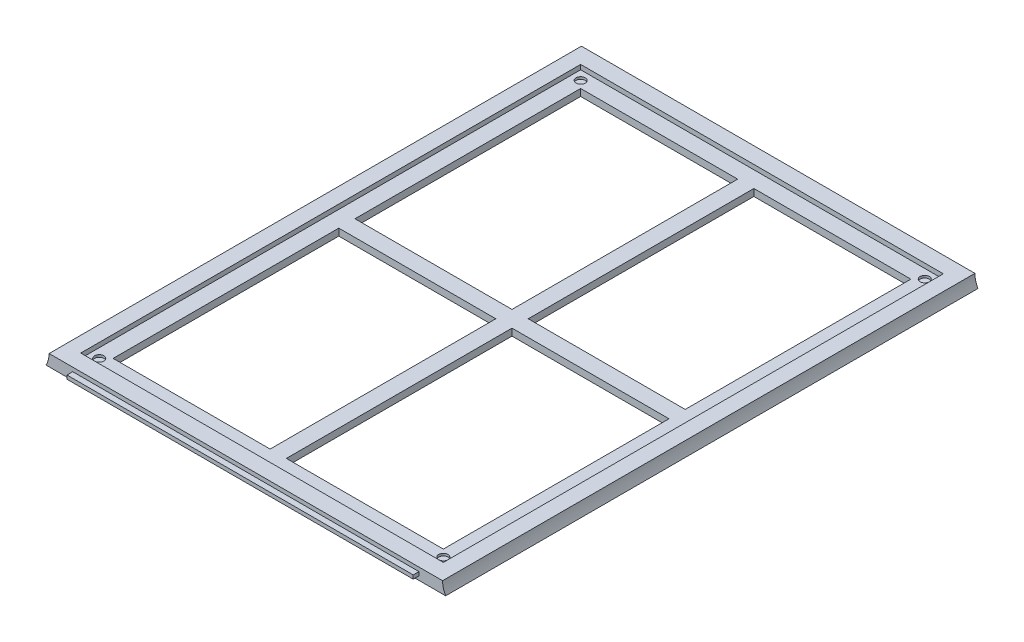
from build123d import *

# Parameters (mm, degrees)
ESBO_O2_W                = 150
ESBO_O2_H                = 2
RESSALTO_EXTRUS_O1_DEPTH = 230
ESBO_O4_W                = 149.6
ESBO_O4_H                = 1.6
RESSALTO_EXTRUS_O2_DEPTH = 2.48
ESBO_O6_W                = 150
ESBO_O6_H                = 2
RESSALTO_EXTRUS_O4_DEPTH = 230
ESBO_O3_W                = 156.68
ESBO_O3_H                = 216
CORTE_EXTRUS_O6_DEPTH    = 2
ESBO_O8_W                = 67.84
ESBO_O8_H                = 97.5
CORTE_EXTRUS_O7_DEPTH    = 20
ESBO_O14_R               = 2
CORTE_EXTRUS_O9_DEPTH    = 1


with BuildPart() as part:
    # Esboço2 → Ressalto-extrusão1 (new body)
    with BuildSketch(Plane.XY):
        with BuildLine():
            Line((-158.025595127, 4.746007498), (11.974404873, 4.746007498))
            ThreePointArc((11.974404873, 4.746007498), (12.315146611, 2.157817047), (13.314150836, -0.253992502))
            Line((13.314150836, -0.253992502), (-159.365341089, -0.253992502))
            ThreePointArc((-159.365341089, -0.253992502), (-158.366336864, 2.157817047), (-158.025595127, 4.746007498))
        make_face()
        with Locations((-73.025595127, 2.246007498)):
            Rectangle(ESBO_O2_W, ESBO_O2_H, mode=Mode.SUBTRACT)
    extrude(amount=RESSALTO_EXTRUS_O1_DEPTH)



with BuildPart() as body_2:
    # Esboço4 → Ressalto-extrusão2 (new body)
    with BuildSketch(Plane.XY.offset(230)):
        with Locations((-73.025595127, 2.246007498)):
            Rectangle(ESBO_O4_W, ESBO_O4_H)
    extrude(amount=RESSALTO_EXTRUS_O2_DEPTH)


with BuildPart() as part_1:
    add(part.part)

    add(body_2.part)  # Ressalto-extrusão4 merges body 2
    # Esboço6 → Ressalto-extrusão4 (add)
    with BuildSketch(Plane(origin=(0, 0, 0), x_dir=(-1, 0, 0), z_dir=(0, 0, -1))):
        with Locations((73.025595127, 2.246007498)):
            Rectangle(ESBO_O6_W, ESBO_O6_H)
    extrude(amount=-RESSALTO_EXTRUS_O4_DEPTH)

    # Esboço3 → Corte-extrusão6 (cut)
    with BuildSketch(Plane.XZ.offset(-4.746007498)):
        with Locations((-73.025595127, 115)):
            Rectangle(ESBO_O3_W, ESBO_O3_H)
    extrude(amount=CORTE_EXTRUS_O6_DEPTH, mode=Mode.SUBTRACT)

    # Esboço8 → Corte-extrusão7 (cut)
    with BuildSketch(Plane(origin=(0, 2.746007498, 0), x_dir=(1, 0, 0), z_dir=(0, 1, 0))):
        with Locations((-110.445595127, -62.75)):
            Rectangle(ESBO_O8_W, ESBO_O8_H)
        with Locations((-35.605595127, -62.75)):
            Rectangle(ESBO_O8_W, ESBO_O8_H)
        with Locations((-110.445595127, -167.25)):
            Rectangle(ESBO_O8_W, ESBO_O8_H)
        with Locations((-35.605595127, -167.25)):
            Rectangle(ESBO_O8_W, ESBO_O8_H)
    extrude(amount=-CORTE_EXTRUS_O7_DEPTH, mode=Mode.SUBTRACT)

    # Esboço14 → Corte-extrusão9 (cut)
    with BuildSketch(Plane(origin=(0, 2.746007498, 0), x_dir=(1, 0, 0), z_dir=(0, 1, 0))):
        with Locations(Location((-147.365595127, -11, 0), (0, 0, 270))):
            Circle(ESBO_O14_R)
        with Locations(Location((1.314404873, -11, 0), (0, 0, 270))):
            Circle(ESBO_O14_R)
        with Locations(Location((-147.365595127, -219, 0), (0, 0, 270))):
            Circle(ESBO_O14_R)
        with Locations(Location((1.314404873, -219, 0), (0, 0, 270))):
            Circle(ESBO_O14_R)
    extrude(amount=-CORTE_EXTRUS_O9_DEPTH, mode=Mode.SUBTRACT)


solid = part_1.part
